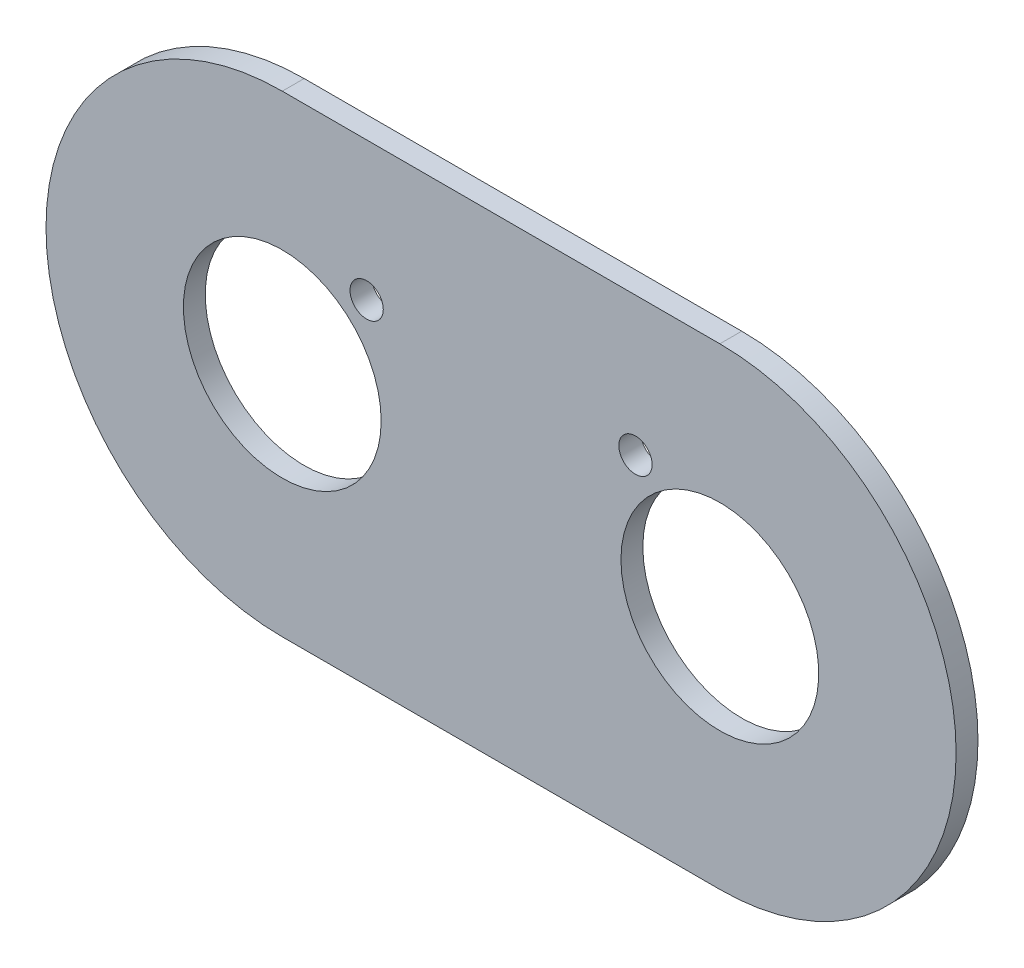
from build123d import *

# Parameters (mm, degrees)
SKETCH1_R           = 14.351
SKETCH1_R_2         = 2.413
BOSS_EXTRUDE1_DEPTH = 3.175


with BuildPart() as part:
    # Sketch1 → Boss-Extrude1 (new body)
    with BuildSketch(Plane.XY):
        with BuildLine():
            Line((-31.75, 34.29), (31.75, 34.29))
            ThreePointArc((31.75, 34.29), (66.04, 0), (31.75, -34.29))
            Line((31.75, -34.29), (-31.75, -34.29))
            ThreePointArc((-31.75, -34.29), (-66.04, 0), (-31.75, 34.29))
        make_face()
        with Locations((-31.75, 0)):
            Circle(SKETCH1_R, mode=Mode.SUBTRACT)
        with Locations(Location((31.75, 0, 0), (0, 0, 180))):
            Circle(SKETCH1_R, mode=Mode.SUBTRACT)
        with Locations((-19.506383886, 14.177461716)):
            Circle(SKETCH1_R_2, mode=Mode.SUBTRACT)
        with Locations(Location((19.506383886, 14.177461716, 0), (0, 0, 180))):
            Circle(SKETCH1_R_2, mode=Mode.SUBTRACT)
    extrude(amount=BOSS_EXTRUDE1_DEPTH)


solid = part.part
